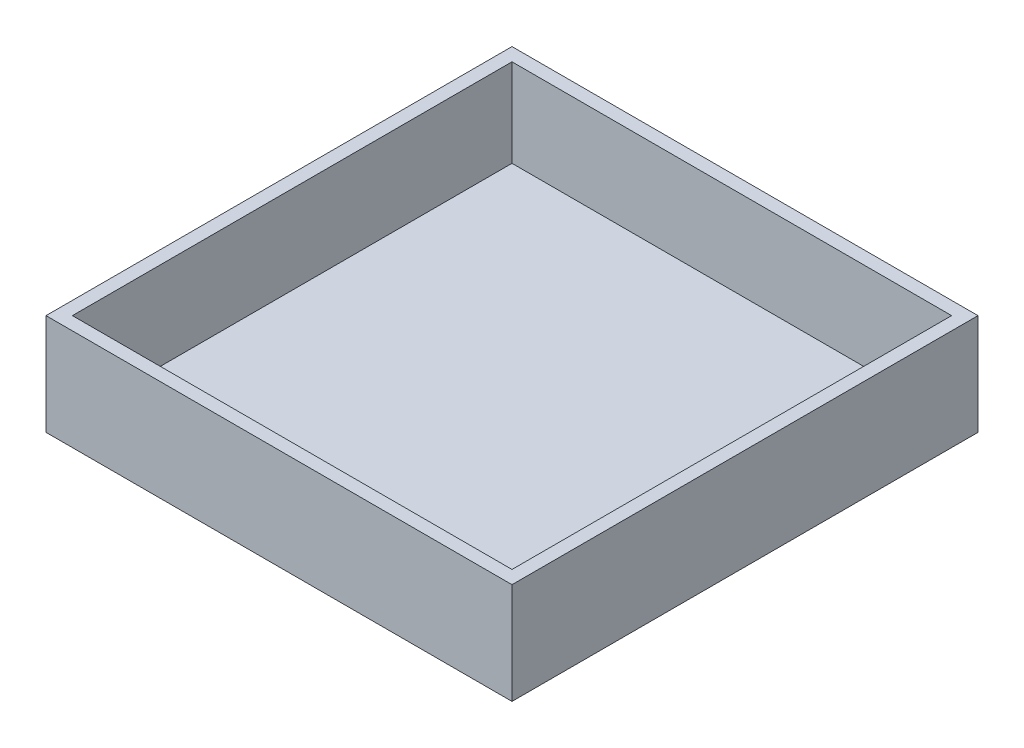
from build123d import *

# Parameters (mm, degrees)
SKETCH1_W           = 106
SKETCH1_H           = 106
BOSS_EXTRUDE1_DEPTH = 23
SHELL1_T            = -3


with BuildPart() as part:
    # Sketch1 → Boss-Extrude1 (new body)
    with BuildSketch(Plane(origin=(0, 0, 0), x_dir=(1, 0, 0), z_dir=(0, 1, 0))):
        Rectangle(SKETCH1_W, SKETCH1_H)
    extrude(amount=BOSS_EXTRUDE1_DEPTH)

    # Shell1
    shell1_openings = [part.faces().sort_by_distance(p)[0] for p in [
        (0, 23, 0),
    ]]
    offset(amount=SHELL1_T, openings=shell1_openings, kind=Kind.INTERSECTION)


solid = part.part
